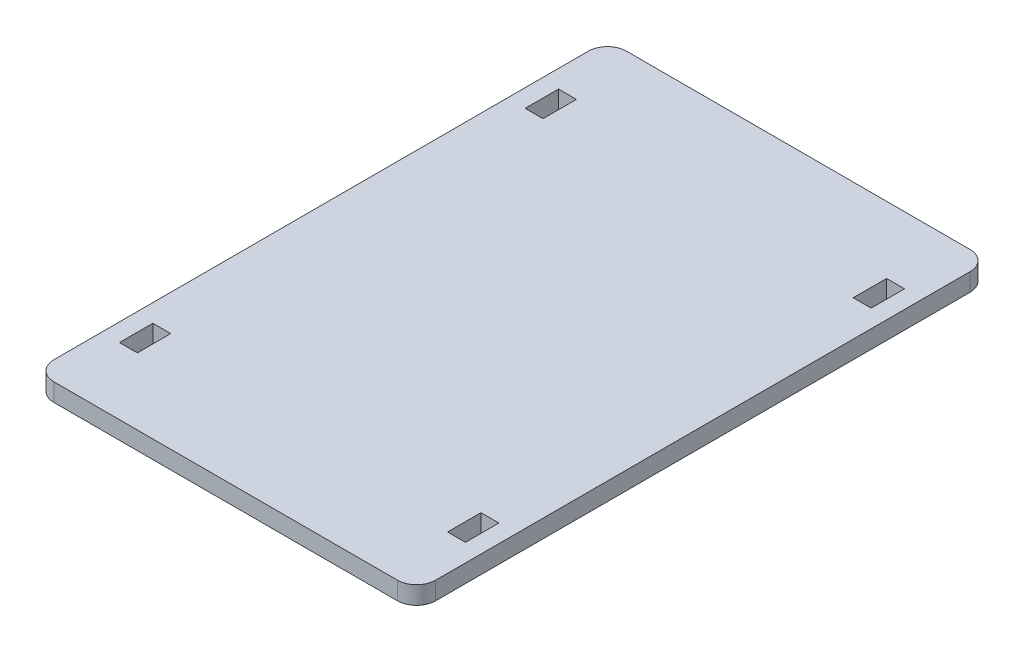
from build123d import *

# Parameters (mm, degrees)
SKETCH1_W           = 101.6
SKETCH1_H           = 152.4
BOSS_EXTRUDE1_DEPTH = 4.7625
SKETCH2_W           = 4.7625
SKETCH2_H           = 8.89
CUT_EXTRUDE1_DEPTH  = 6.35
FILLET1_R           = 5.08


with BuildPart() as part:
    # Sketch1 → Boss-Extrude1 (new body)
    with BuildSketch(Plane(origin=(0, 0, 0), x_dir=(1, 0, 0), z_dir=(0, 1, 0))):
        with Locations((-50.8, 76.2)):
            Rectangle(SKETCH1_W, SKETCH1_H)
    extrude(amount=BOSS_EXTRUDE1_DEPTH)

    # Sketch2 → Cut-Extrude1 (cut)
    with BuildSketch(Plane(origin=(0, 4.7625, 0), x_dir=(1, 0, 0), z_dir=(0, 1, 0))):
        with Locations((-7.14375, 130.175)):
            Rectangle(SKETCH2_W, SKETCH2_H)
        with Locations((-94.45625, 130.175)):
            Rectangle(SKETCH2_W, SKETCH2_H)
        with Locations((-7.14375, 22.225)):
            Rectangle(SKETCH2_W, SKETCH2_H)
        with Locations((-94.45625, 22.225)):
            Rectangle(SKETCH2_W, SKETCH2_H)
    extrude(amount=-CUT_EXTRUDE1_DEPTH, mode=Mode.SUBTRACT)

    # Fillet1
    fillet1_edges = [part.edges().sort_by_distance(p)[0] for p in [
        (0, 2.38125, 0),
        (-101.6, 2.38125, 0),
        (-101.6, 2.38125, -152.4),
        (0, 2.38125, -152.4),
    ]]
    fillet(fillet1_edges, radius=FILLET1_R)


solid = part.part
